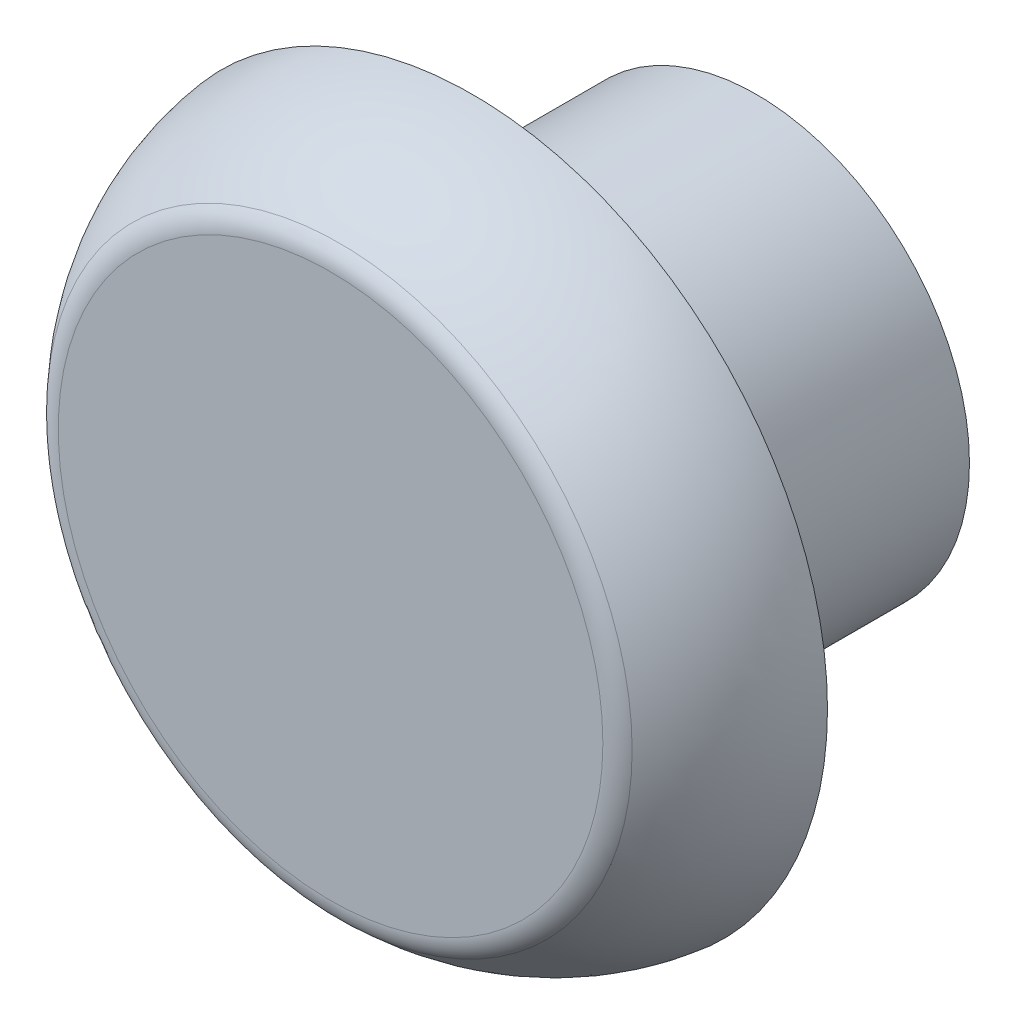
from build123d import *

# Parameters (mm, degrees)
CROQUIS1_R              = 1.5
SALIENTE_EXTRUIR1_DEPTH = 2
CROQUIS2_R              = 2.5
SALIENTE_EXTRUIR2_DEPTH = 1
REDONDEO3_R             = 0.2


with BuildPart() as part:
    # Croquis1 → Saliente-Extruir1 (new body)
    with BuildSketch(Plane.XY):
        Circle(CROQUIS1_R)
    extrude(amount=SALIENTE_EXTRUIR1_DEPTH)

    # Croquis2 → Saliente-Extruir2 (add)
    with BuildSketch(Plane.XY.offset(2)):
        Circle(CROQUIS2_R)
    extrude(amount=SALIENTE_EXTRUIR2_DEPTH)

    # Croquis3 → Cortar-Revolución1 (revolve, cut)
    with BuildSketch(Plane(origin=(0, 0, 0), x_dir=(0, 0, -1), z_dir=(1, 0, 0)), mode=Mode.PRIVATE) as cortar_revoluci_n1_sk:
        with BuildLine():
            Line((-2, 2.5), (-3, 2.5))
            Line((-3, 2.5), (-3, 2))
            ThreePointArc((-3, 2), (-2.54475609, 2.33951218), (-2, 2.5))
        make_face()
    revolve(cortar_revoluci_n1_sk.sketch.rotate(Axis((0, 0, 0), (0, 0, 1)), 90), axis=Axis((0, 0, 0), (0, 0, 1)), mode=Mode.SUBTRACT)

    # Redondeo3
    redondeo3_edges = [part.edges().sort_by_distance(p)[0] for p in [
        (2, 0, 3),
    ]]
    fillet(redondeo3_edges, radius=REDONDEO3_R)


solid = part.part
